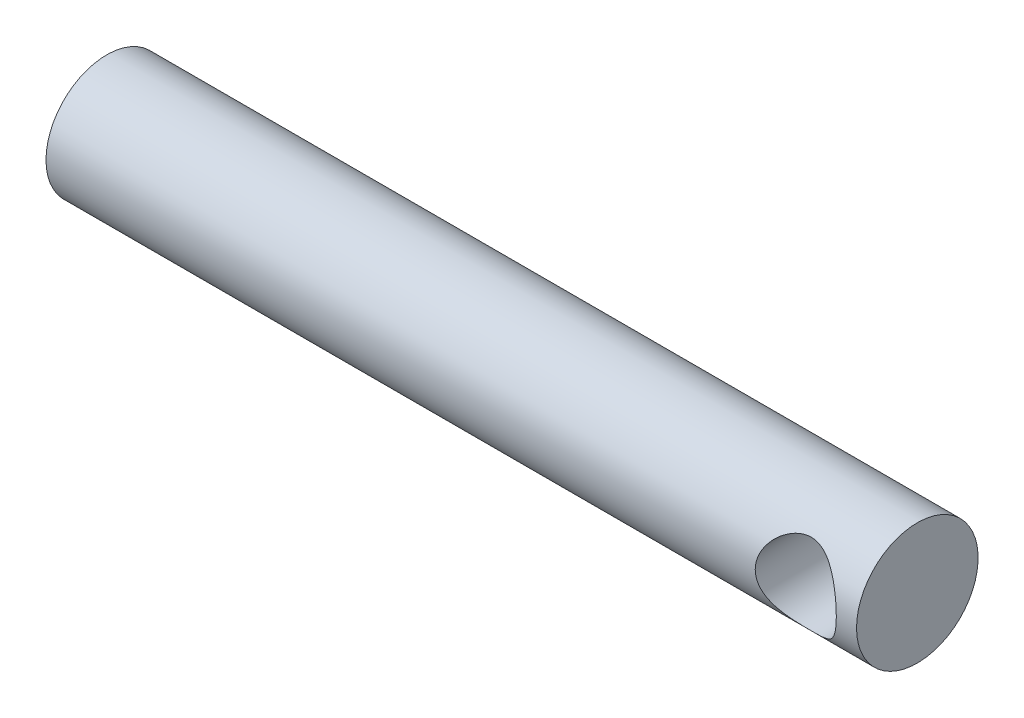
from build123d import *

# Parameters (mm, degrees)
SKETCH1_W               = 40
SKETCH1_H               = 3
CUT_EXTRUDE1_DEPTH      = 10
CUT_EXTRUDE1_DEPTH_BACK = 10
SKETCH2_R               = 2


with BuildPart() as part:
    # Sketch1 → Revolve1 (revolve)
    with BuildSketch(Plane.XY):
        with Locations((0, 1.5)):
            Rectangle(SKETCH1_W, SKETCH1_H)
    revolve(axis=Axis((-20, 0, 0), (1, 0, 0)))

    # Sketch2 → Cut-Extrude1 (cut, two sides: drawn at the far end of the back side and taken through both)
    with BuildSketch(Plane.XY.offset(-CUT_EXTRUDE1_DEPTH_BACK)):
        with Locations((17, 0)):
            Circle(SKETCH2_R)
    extrude(amount=CUT_EXTRUDE1_DEPTH + CUT_EXTRUDE1_DEPTH_BACK, mode=Mode.SUBTRACT)


solid = part.part
